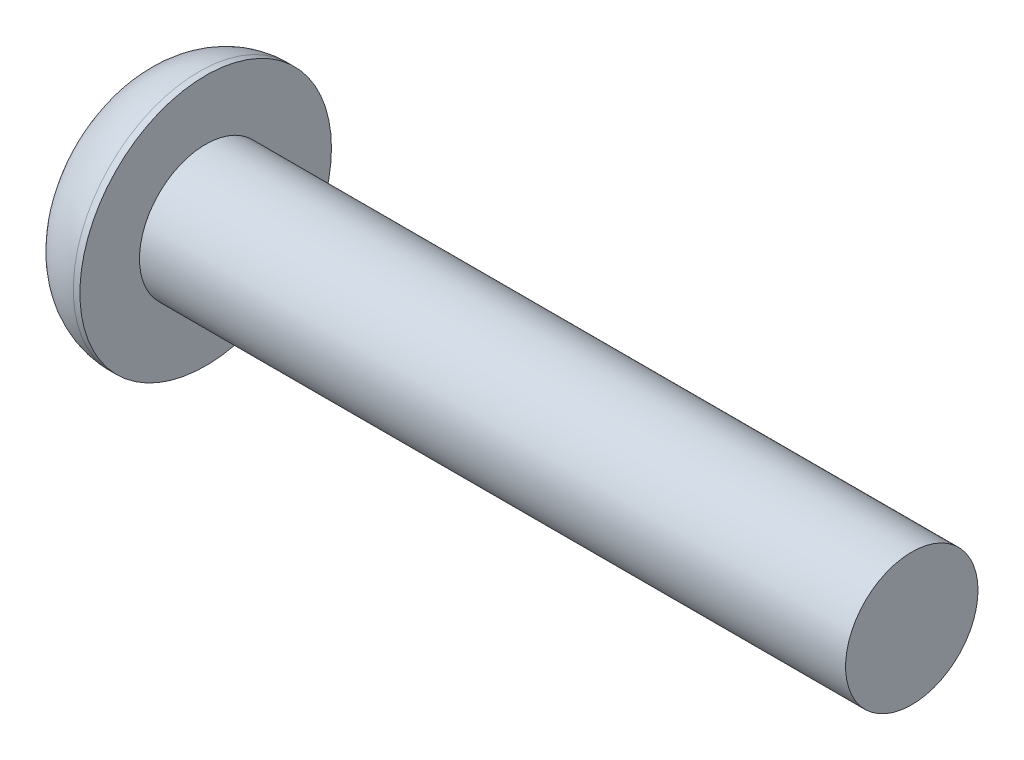
from build123d import *

# Parameters (mm, degrees)
CUT_EXTRUDE1_DEPTH = 1.04


with BuildPart() as part:
    # Sketch1 → Revolve1 (revolve)
    with BuildSketch(Plane(origin=(0, 0, 0), x_dir=(1, 0, 0), z_dir=(0, 1, 0))):
        with BuildLine():
            Line((0, 0), (17.65, 0))
            Line((17.65, 0), (17.65, 1.5))
            Line((17.65, 1.5), (1.65, 1.5))
            Line((1.65, 1.5), (1.65, 2.85))
            Line((1.65, 2.85), (1.5, 2.85))
            ThreePointArc((1.5, 2.85), (0.439339828, 2.410660172), (0, 1.35))
            Line((0, 1.35), (0, 0))
        make_face()
    revolve(axis=Axis((0, 0, 0), (-1, 0, 0)))

    # Sketch2 → Cut-Extrude1 (cut)
    with BuildSketch(Plane.ZY):
        Polygon((1.154700538, 0), (0.577350269, 1), (-0.577350269, 1), (-1.154700538, 0), (-0.577350269, -1), (0.577350269, -1), align=None)
    extrude(amount=-CUT_EXTRUDE1_DEPTH, mode=Mode.SUBTRACT)


solid = part.part
